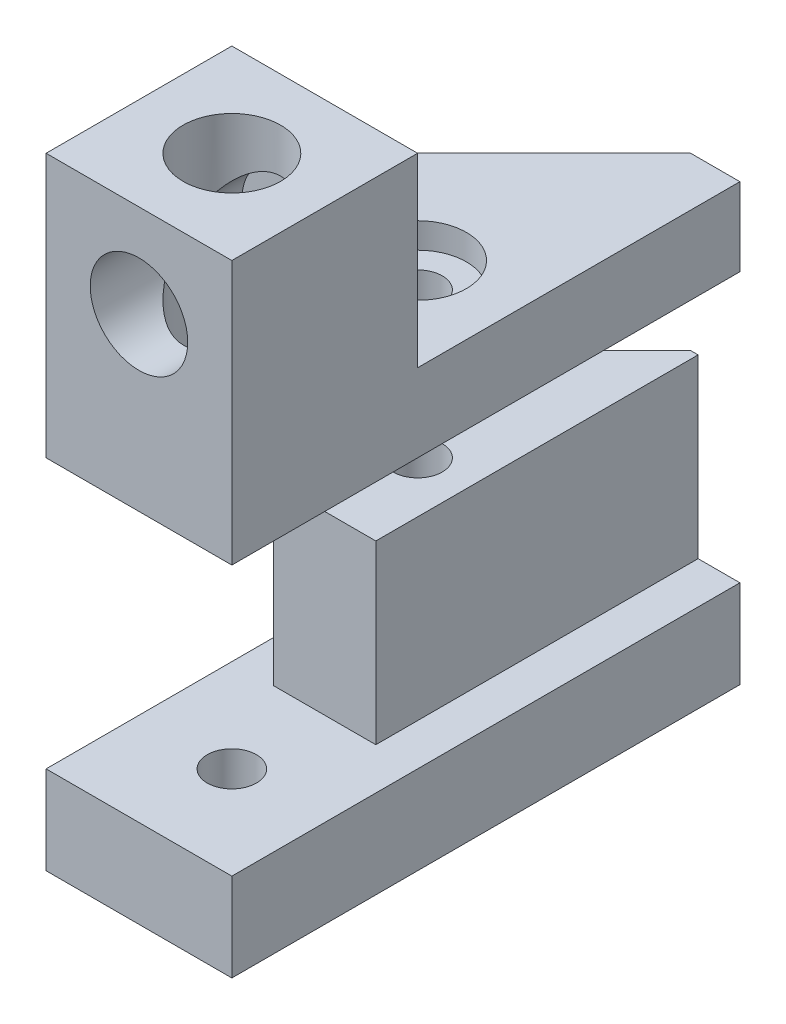
from build123d import *

# Parameters (mm, degrees)
IDLER_BOTTOM_PLATE_DEPTH       = 9.5
CONNECT_WALL_DEPTH             = 19
IDLER_TOP_PLATE_DEPTH          = 8.4
SKETCH6_W                      = 20
SKETCH6_H                      = 20
F_2020_BRACE_DEPTH             = 20
SKETCH7_R                      = 5.25
CUT_EXTRUDE1_DEPTH             = 20
SKETCH8_R                      = 5.25
CUT_EXTRUDE2_DEPTH             = 13.6
CBORE_FOR_M5_SBHCS4_AT_2_COUNT = 2
CBORE_FOR_M5_SBHCS4_AT_2_PITCH = 20


with BuildPart() as part:
    # Sketch2 → idler bottom plate (new body)
    with BuildSketch(Plane(origin=(0, 0, 0), x_dir=(1, 0, 0), z_dir=(0, 1, 0))):
        Polygon((10, -10), (-10, -10), (-10, 30), (4.7, 44.7), (10, 44.7), (10, 30), align=None)
    extrude(amount=IDLER_BOTTOM_PLATE_DEPTH)

    # Sketch4 → connect wall (add)
    with BuildSketch(Plane(origin=(0, 9.5, 0), x_dir=(1, 0, 0), z_dir=(0, 1, 0))):
        Polygon((-5.5, 30), (-5.5, 10), (5.5, 10), (5.5, 30), (5.5, 44.7), (4.7, 44.7), (-5.5, 34.5), align=None)
    extrude(amount=CONNECT_WALL_DEPTH)


with BuildPart() as body_2:
    # Sketch5 → idler top plate (new body)
    with BuildSketch(Plane(origin=(0, 38.5, 0), x_dir=(1, 0, 0), z_dir=(0, 1, 0))):
        Polygon((-10, 30), (4.7, 44.7), (10, 44.7), (10, 30), (10, -10), (-10, -10), align=None)
    extrude(amount=IDLER_TOP_PLATE_DEPTH)

    # Sketch6 → 2020 brace (add)
    with BuildSketch(Plane(origin=(0, 46.9, 0), x_dir=(1, 0, 0), z_dir=(0, 1, 0))):
        Rectangle(SKETCH6_W, SKETCH6_H)
    extrude(amount=F_2020_BRACE_DEPTH)

    # Sketch7 → Cut-Extrude1 (cut)
    with BuildSketch(Plane(origin=(0, 66.9, 0), x_dir=(1, 0, 0), z_dir=(0, 1, 0))):
        with Locations(Location((0, 0, 0), (0, 0, 270))):
            Circle(SKETCH7_R)
    extrude(amount=-CUT_EXTRUDE1_DEPTH, mode=Mode.SUBTRACT)

    # Sketch8 → Cut-Extrude2 (cut)
    with BuildSketch(Plane.XY.offset(10)):
        with Locations((0, 56.9)):
            Circle(SKETCH8_R)
    extrude(amount=-CUT_EXTRUDE2_DEPTH, mode=Mode.SUBTRACT)


with BuildPart() as cbore_for_m5_sbhcs4_tool:
    # Sketch16 → CBORE for M5 SBHCS4 (revolve)
    with BuildSketch(Plane(origin=(0, 46.9, -20), x_dir=(0, 0, 1), z_dir=(1, 0, 0))):
        Polygon((0, 0), (0, 46.9), (2.65, 46.9), (2.65, 2.75), (5.25, 2.75), (5.25, 0), align=None)
    cbore_for_m5_sbhcs4 = revolve(axis=Axis((0, 53.25, -20), (0, -1, 0)))


with BuildPart() as part_1:
    add(part.part)

    # CBORE for M5 SBHCS4: cut by cbore_for_m5_sbhcs4_tool
    add(cbore_for_m5_sbhcs4_tool.part, mode=Mode.SUBTRACT)


with BuildPart() as body_2_1:
    add(body_2.part)

    # CBORE for M5 SBHCS4: cut by cbore_for_m5_sbhcs4_tool
    add(cbore_for_m5_sbhcs4_tool.part, mode=Mode.SUBTRACT)


with BuildPart() as cbore_for_m5_sbhcs4_at_2_tool:
    # CBORE for M5 SBHCS4 at 2: CBORE for M5 SBHCS4 ×2
    with Locations(*[(0, 0, i * CBORE_FOR_M5_SBHCS4_AT_2_PITCH) for i in range(1, CBORE_FOR_M5_SBHCS4_AT_2_COUNT)]):
        add(cbore_for_m5_sbhcs4)


with BuildPart() as part_2:
    add(part_1.part)

    # CBORE for M5 SBHCS4 at 2: cut by cbore_for_m5_sbhcs4_at_2_tool
    add(cbore_for_m5_sbhcs4_at_2_tool.part, mode=Mode.SUBTRACT)


with BuildPart() as body_2_2:
    add(body_2_1.part)

    # CBORE for M5 SBHCS4 at 2: cut by cbore_for_m5_sbhcs4_at_2_tool
    add(cbore_for_m5_sbhcs4_at_2_tool.part, mode=Mode.SUBTRACT)

    # Sketch11 → CBORE for M5 SBHCS2 (revolve, cut)
    with BuildSketch(Plane(origin=(0, 56.9, -3.6), x_dir=(0, -1, 0), z_dir=(1, 0, 0))):
        Polygon((0, 0), (0, 41.1), (2.65, 41.1), (2.65, 2.75), (5.25, 2.75), (5.25, 0), align=None)
    revolve(axis=Axis((0, 56.9, 2.75), (0, 0, -1)), mode=Mode.SUBTRACT)


solid = Compound([part_2.part, body_2_2.part])
